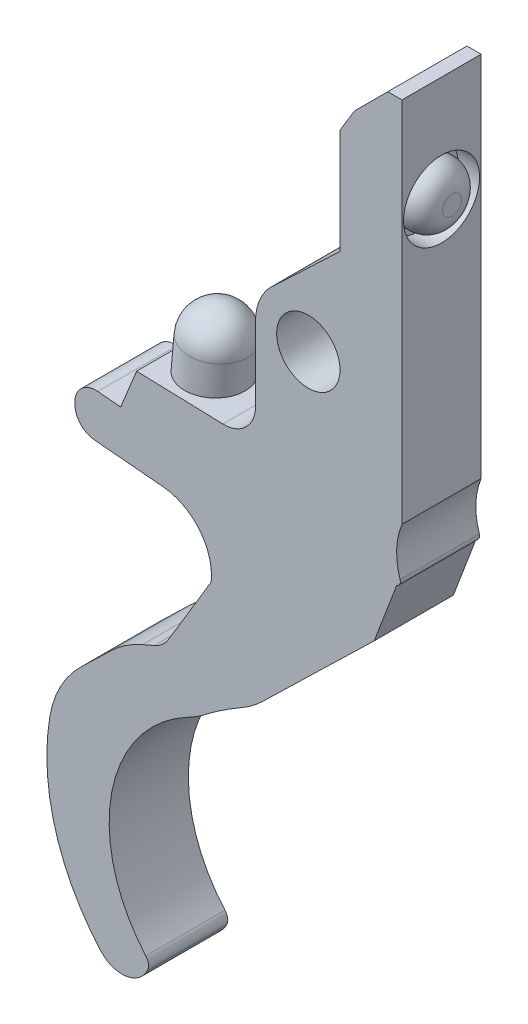
from build123d import *

# Parameters (mm, degrees)
SKETCH_1_R          = 5
SKETCH_1_R_2        = 3
EXTRUDE_1_DEPTH     = 7.5
SKETCH_2_R          = 3.6
CUT_EXTRUDE_1_DEPTH = 2
SKETCH_3_R          = 2.9
EXTRUDE_2_DEPTH     = 3
FILLET_1_R          = 2
SKETCH_4_R          = 2.9
EXTRUDE_3_DEPTH     = 10
FILLET_2_R          = 2.9
FILLET_3_R          = 3


with BuildPart() as part:
    # 스케치1 → 보스-돌출1 (new body)
    # profile 1 of 5: a face of its own
    with BuildSketch(Plane.XY):
        with BuildLine():
            Line((8.866410343, 21.94338903), (4.384187039, 21.94338903))
            Line((4.384187039, 21.94338903), (2.987768149, 19.65002342))
            Line((2.987768149, 19.65002342), (2.987768149, 17.661246793))
            Line((2.987768149, 17.661246793), (2.987768149, 9.70876495))
            Line((2.987768149, 9.70876495), (-3.184671245, 3.854590647))
            ThreePointArc((-3.184671245, 3.854590647), (2.13033375, 4.523458645), (5, 0))
            ThreePointArc((5, 0), (0, -5), (-5, 0))
            Line((-5, 0), (-5, -10.071407464))
            Line((-5, -10.071407464), (-16.264805165, -9.728236855))
            Line((-16.264805165, -9.728236855), (-17.766639728, -13.42657959))
            Line((-17.766639728, -13.42657959), (-19.940502755, -13.22881584))
            ThreePointArc((-19.940502755, -13.22881584), (-21.568981751, -13.840235901), (-22.102673306, -15.49581787))
            ThreePointArc((-22.102673306, -15.49581787), (-21.54079944, -16.765444299), (-20.287735083, -17.363343312))
            Line((-20.287735083, -17.363343312), (-13.716958703, -17.9611093))
            ThreePointArc((-13.716958703, -17.9611093), (-10.295562947, -19.77999502), (-9.201017746, -23.497018692))
            Line((-9.201017746, -23.497018692), (-13.218080179, -30.193463728))
            ThreePointArc((-13.218080179, -30.193463728), (-13.817495958, -30.9099569), (-14.608237914, -31.407338947))
            Line((-14.608237914, -31.407338947), (-15.680360182, -31.867141901))
            ThreePointArc((-15.680360182, -31.867141901), (-17.282818205, -32.73507756), (-18.70115036, -33.879419256))
            Line((-18.70115036, -33.879419256), (-21.587390027, -36.678865361))
            ThreePointArc((-21.587390027, -36.678865361), (-23.484754079, -39.219572782), (-24.491261067, -42.226585957))
            ThreePointArc((-24.491261067, -42.226585957), (-23.966473892, -51.146683639), (-19.652431958, -58.971808969))
            ThreePointArc((-19.652431958, -58.971808969), (-17.283591849, -59.850561763), (-15.231880476, -58.376082064))
            ThreePointArc((-15.231880476, -58.376082064), (-15.139015744, -57.789610004), (-15.395055283, -57.253870245))
            ThreePointArc((-15.395055283, -57.253870245), (-18.621303847, -45.462540141), (-11.334185384, -35.647141528))
            ThreePointArc((-11.334185384, -35.647141528), (-10.571184727, -35.206851872), (-9.849893086, -34.701121359))
            ThreePointArc((-9.849893086, -34.701121359), (-8.133553397, -33.471894478), (-6.337557558, -32.362291125))
            ThreePointArc((-6.337557558, -32.362291125), (-5.290911527, -31.673468731), (-4.338619501, -30.85916897))
            Line((-4.338619501, -30.85916897), (6.238088337, -20.600518625))
            Line((6.238088337, -20.600518625), (8.3701186, -14.978169718))
            ThreePointArc((8.3701186, -14.978169718), (8.662275884, -14.729272874), (8.69193724, -14.346616734))
            ThreePointArc((8.69193724, -14.346616734), (8.365752146, -12.021808556), (8.866410343, -9.728236855))
            Line((8.866410343, -9.728236855), (8.866410343, 21.94338903))
        make_face()
    # profile 2 of 5: a face of its own
    with BuildSketch(Plane.XY):
        Circle(SKETCH_1_R)
        Circle(SKETCH_1_R_2, mode=Mode.SUBTRACT)
    # profile 3 of 5: a face of its own
    with BuildSketch(Plane.XY):
        with BuildLine():
            ThreePointArc((5, 0), (2.13033375, 4.523458645), (-3.184671245, 3.854590647))
            ThreePointArc((-3.184671245, 3.854590647), (-4.523458645, 2.13033375), (-5, 0))
            ThreePointArc((-5, 0), (0, -5), (5, 0))
        make_face()
        Circle(SKETCH_1_R_2, mode=Mode.SUBTRACT)
    # profile 4 of 5: a face of its own
    with BuildSketch(Plane.XY):
        Polygon((8.866410343, 25.078081763), (7.518879772, 25.078081763), (4.384187039, 21.94338903), (8.866410343, 21.94338903), align=None)
    # profile 5 of 5: a face of its own
    with BuildSketch(Plane.XY):
        with BuildLine():
            Line((8.866410343, 21.94338903), (4.384187039, 21.94338903))
            Line((4.384187039, 21.94338903), (2.987768149, 19.65002342))
            Line((2.987768149, 19.65002342), (2.987768149, 17.661246793))
            Line((2.987768149, 17.661246793), (2.987768149, 9.70876495))
            Line((2.987768149, 9.70876495), (-3.184671245, 3.854590647))
            ThreePointArc((-3.184671245, 3.854590647), (2.13033375, 4.523458645), (5, 0))
            ThreePointArc((5, 0), (0, -5), (-5, 0))
            Line((-5, 0), (-5, -10.071407464))
            Line((-5, -10.071407464), (-16.264805165, -9.728236855))
            Line((-16.264805165, -9.728236855), (-17.766639728, -13.42657959))
            Line((-17.766639728, -13.42657959), (-19.940502755, -13.22881584))
            ThreePointArc((-19.940502755, -13.22881584), (-21.568981751, -13.840235901), (-22.102673306, -15.49581787))
            ThreePointArc((-22.102673306, -15.49581787), (-21.54079944, -16.765444299), (-20.287735083, -17.363343312))
            Line((-20.287735083, -17.363343312), (-13.716958703, -17.9611093))
            ThreePointArc((-13.716958703, -17.9611093), (-10.295562947, -19.77999502), (-9.201017746, -23.497018692))
            Line((-9.201017746, -23.497018692), (-13.218080179, -30.193463728))
            ThreePointArc((-13.218080179, -30.193463728), (-13.817495958, -30.9099569), (-14.608237914, -31.407338947))
            Line((-14.608237914, -31.407338947), (-15.680360182, -31.867141901))
            ThreePointArc((-15.680360182, -31.867141901), (-17.282818205, -32.73507756), (-18.70115036, -33.879419256))
            Line((-18.70115036, -33.879419256), (-21.587390027, -36.678865361))
            ThreePointArc((-21.587390027, -36.678865361), (-23.484754079, -39.219572782), (-24.491261067, -42.226585957))
            ThreePointArc((-24.491261067, -42.226585957), (-23.966473892, -51.146683639), (-19.652431958, -58.971808969))
            ThreePointArc((-19.652431958, -58.971808969), (-17.283591849, -59.850561763), (-15.231880476, -58.376082064))
            ThreePointArc((-15.231880476, -58.376082064), (-15.139015744, -57.789610004), (-15.395055283, -57.253870245))
            ThreePointArc((-15.395055283, -57.253870245), (-18.621303847, -45.462540141), (-11.334185384, -35.647141528))
            ThreePointArc((-11.334185384, -35.647141528), (-10.571184727, -35.206851872), (-9.849893086, -34.701121359))
            ThreePointArc((-9.849893086, -34.701121359), (-8.133553397, -33.471894478), (-6.337557558, -32.362291125))
            ThreePointArc((-6.337557558, -32.362291125), (-5.290911527, -31.673468731), (-4.338619501, -30.85916897))
            Line((-4.338619501, -30.85916897), (6.238088337, -20.600518625))
            Line((6.238088337, -20.600518625), (8.3701186, -14.978169718))
            ThreePointArc((8.3701186, -14.978169718), (8.662275884, -14.729272874), (8.69193724, -14.346616734))
            ThreePointArc((8.69193724, -14.346616734), (8.365752146, -12.021808556), (8.866410343, -9.728236855))
            Line((8.866410343, -9.728236855), (8.866410343, 21.94338903))
        make_face()
    extrude(amount=EXTRUDE_1_DEPTH)

    # 스케치2 → 컷-돌출1 (cut)
    with BuildSketch(Plane(origin=(8.866410343, 0, 0), x_dir=(0, 0, -1), z_dir=(1, 0, 0))):
        with Locations(Location((-3.75, 15.078081763, 0), (0, 0, 90))):
            Circle(SKETCH_2_R)
    extrude(amount=-CUT_EXTRUDE_1_DEPTH, mode=Mode.SUBTRACT)

    # 스케치3 → 보스-돌출2 (add)
    with BuildSketch(Plane(origin=(6.866410343, 0, 0), x_dir=(0, 0, -1), z_dir=(1, 0, 0))):
        with Locations(Location((-3.75, 15.078081763, 0), (0, 0, 90))):
            Circle(SKETCH_3_R)
    extrude(amount=EXTRUDE_2_DEPTH)

    # 필렛1
    fillet_1_edges = [part.edges().sort_by_distance(p)[0] for p in [
        (9.866410343, 12.178081763, 3.75),
    ]]
    fillet(fillet_1_edges, radius=FILLET_1_R)

    # 스케치4 → 보스-돌출3 (add)
    with BuildSketch(Plane(origin=(-1.357268469, -14.919396185, 0), x_dir=(0.995887428286197, -0.09059928355955607, 0), z_dir=(0.09059928355955607, 0.995887428286197, 0))):
        with Locations(Location((-11.657618139, -3.8, 0), (0, 0, 180))):
            Circle(SKETCH_4_R)
    extrude(amount=EXTRUDE_3_DEPTH)

    # 필렛2
    fillet_2_edges = [part.edges().sort_by_distance(p)[0] for p in [
        (-9.17287744, -4.167087973, 3.8),
    ]]
    fillet(fillet_2_edges, radius=FILLET_2_R)

    # 필렛3
    fillet_3_edges = [part.edges().sort_by_distance(p)[0] for p in [
        (-5, -10.071407464, 3.75),
    ]]
    fillet(fillet_3_edges, radius=FILLET_3_R)


solid = part.part
